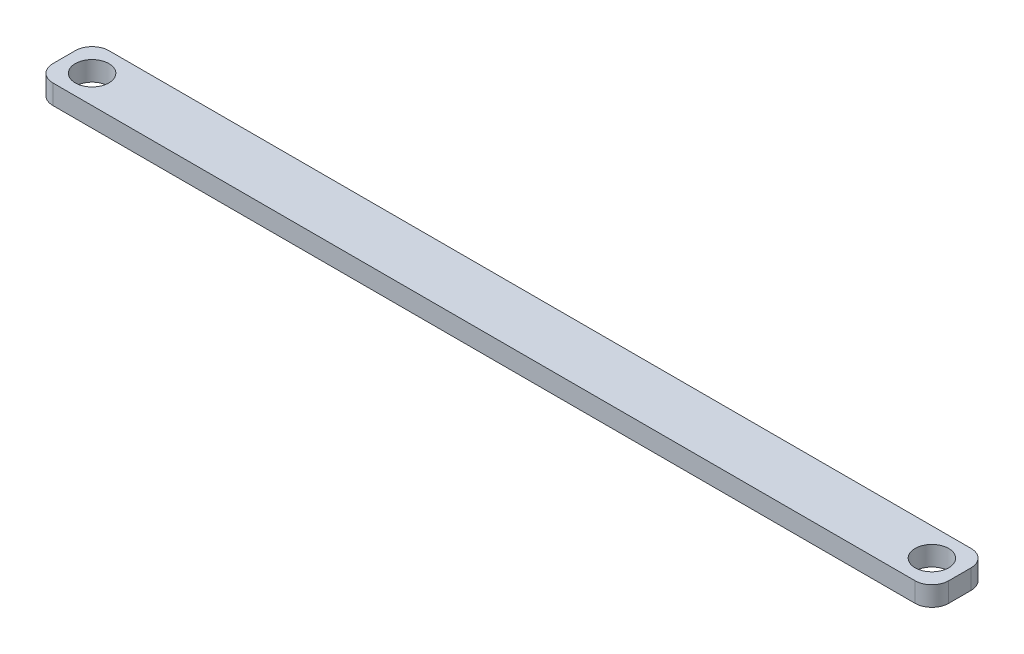
from build123d import *

# Parameters (mm, degrees)
SKETCH1_R           = 3
BOSS_EXTRUDE1_DEPTH = 3.5


with BuildPart() as part:
    # Sketch1 → Boss-Extrude1 (new body)
    with BuildSketch(Plane(origin=(0, 0, 0), x_dir=(1, 0, 0), z_dir=(0, 1, 0))):
        with BuildLine():
            Line((3, 0), (157, 0))
            ThreePointArc((157, 0), (159.121320344, -0.878679656), (160, -3))
            Line((160, -3), (160, -7))
            ThreePointArc((160, -7), (159.121320344, -9.121320344), (157, -10))
            Line((157, -10), (3, -10))
            ThreePointArc((3, -10), (0.878679656, -9.121320344), (0, -7))
            Line((0, -7), (0, -3))
            ThreePointArc((0, -3), (0.878679656, -0.878679656), (3, 0))
        make_face()
        with Locations(Location((5, -5, 0), (0, 0, 270))):
            Circle(SKETCH1_R, mode=Mode.SUBTRACT)
        with Locations(Location((155, -5, 0), (0, 0, 270))):
            Circle(SKETCH1_R, mode=Mode.SUBTRACT)
    extrude(amount=BOSS_EXTRUDE1_DEPTH)


solid = part.part
